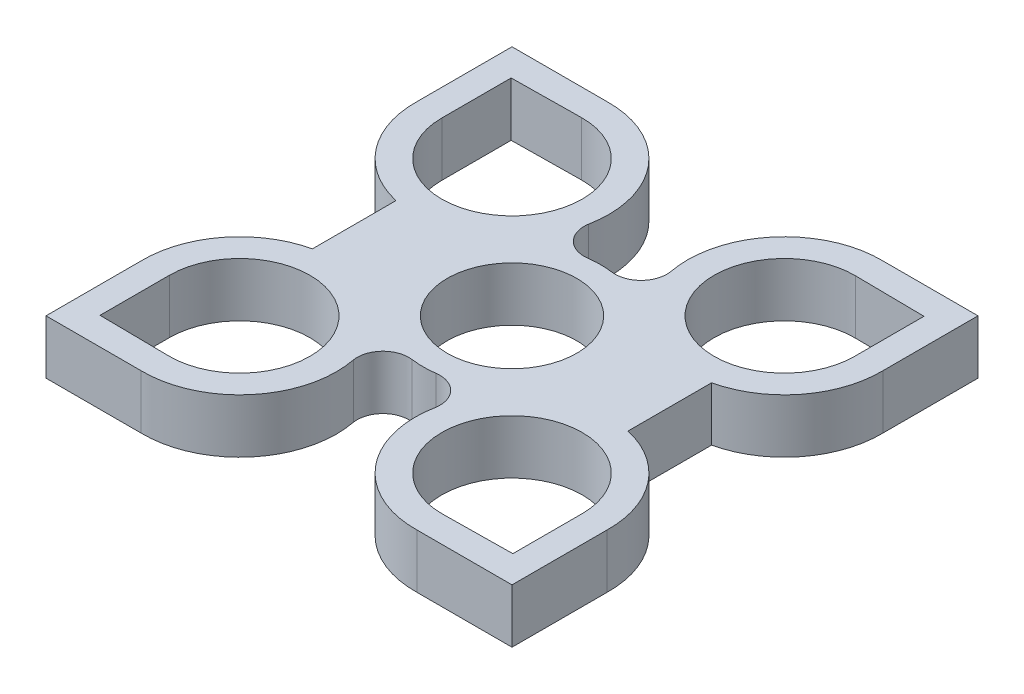
from build123d import *

# Parameters (mm, degrees)
SKETCH1_R           = 30
BOSS_EXTRUDE1_DEPTH = 25


with BuildPart() as part:
    # Sketch1 → Boss-Extrude1 (new body)
    with BuildSketch(Plane(origin=(0, 0, 0), x_dir=(1, 0, 0), z_dir=(0, 1, 0))):
        with BuildLine():
            Line((-63.8, 107.8), (-107.8, 107.8))
            Line((-107.8, 107.8), (-107.8, 63.8))
            ThreePointArc((-107.8, 63.8), (-98.288961426, 35.388965946), (-73, 19.323003766))
            Line((-73, 19.323003766), (-73, -19.323003766))
            ThreePointArc((-73, -19.323003766), (-98.288961426, -35.388965946), (-107.8, -63.8))
            Line((-107.8, -63.8), (-107.8, -107.8))
            Line((-107.8, -107.8), (-63.8, -107.8))
            ThreePointArc((-63.8, -107.8), (-28.653661458, -91.775146025), (-19.03272249, -54.365273115))
            ThreePointArc((-19.03272249, -54.365273115), (-15.743256927, -44.108614607), (-5.551800988, -40.62237691))
            ThreePointArc((-5.551800988, -40.62237691), (0, -41), (5.551800988, -40.62237691))
            ThreePointArc((5.551800988, -40.62237691), (15.743256927, -44.108614607), (19.03272249, -54.365273115))
            ThreePointArc((19.03272249, -54.365273115), (28.653661458, -91.775146025), (63.8, -107.8))
            Line((63.8, -107.8), (107.8, -107.8))
            Line((107.8, -107.8), (107.8, -63.8))
            ThreePointArc((107.8, -63.8), (98.288961426, -35.388965946), (73, -19.323003766))
            Line((73, -19.323003766), (73, 19.323003766))
            ThreePointArc((73, 19.323003766), (98.288961426, 35.388965946), (107.8, 63.8))
            Line((107.8, 63.8), (107.8, 107.8))
            Line((107.8, 107.8), (63.8, 107.8))
            ThreePointArc((63.8, 107.8), (28.653661458, 91.775146025), (19.03272249, 54.365273115))
            ThreePointArc((19.03272249, 54.365273115), (15.743256927, 44.108614607), (5.551800988, 40.62237691))
            ThreePointArc((5.551800988, 40.62237691), (0, 41), (-5.551800988, 40.62237691))
            ThreePointArc((-5.551800988, 40.62237691), (-15.743256927, 44.108614607), (-19.03272249, 54.365273115))
            ThreePointArc((-19.03272249, 54.365273115), (-28.653661458, 91.775146025), (-63.8, 107.8))
        make_face()
        with BuildLine():
            Line((-94.245355165, -95.115537993), (-95.5, -95.1))
            Line((-95.5, -95.1), (-95.5, -93.845258955))
            Line((-95.5, -93.845258955), (-95.5, -63))
            ThreePointArc((-95.5, -63), (-39.877175844, -40.161764449), (-63.40246135, -95.497507979))
            Line((-63.40246135, -95.497507979), (-94.245355165, -95.115537993))
        make_face(mode=Mode.SUBTRACT)
        with BuildLine():
            Line((95.5, -93.845258955), (95.5, -95.1))
            Line((95.5, -95.1), (94.245355165, -95.115537993))
            Line((94.245355165, -95.115537993), (63.40246135, -95.497507979))
            ThreePointArc((63.40246135, -95.497507979), (39.877175844, -40.161764449), (95.5, -63))
            Line((95.5, -63), (95.5, -93.845258955))
        make_face(mode=Mode.SUBTRACT)
        with Locations(Location((0, 0, 0), (0, 0, 270))):
            Circle(SKETCH1_R, mode=Mode.SUBTRACT)
        with BuildLine():
            Line((-95.5, 93.845258955), (-95.5, 95.1))
            Line((-95.5, 95.1), (-94.245355165, 95.115537993))
            Line((-94.245355165, 95.115537993), (-63.40246135, 95.497507979))
            ThreePointArc((-63.40246135, 95.497507979), (-39.877175844, 40.161764449), (-95.5, 63))
            Line((-95.5, 63), (-95.5, 93.845258955))
        make_face(mode=Mode.SUBTRACT)
        with BuildLine():
            Line((94.245355165, 95.115537993), (95.5, 95.1))
            Line((95.5, 95.1), (95.5, 93.845258955))
            Line((95.5, 93.845258955), (95.5, 63))
            ThreePointArc((95.5, 63), (39.877175844, 40.161764449), (63.40246135, 95.497507979))
            Line((63.40246135, 95.497507979), (94.245355165, 95.115537993))
        make_face(mode=Mode.SUBTRACT)
    extrude(amount=BOSS_EXTRUDE1_DEPTH)


solid = part.part
